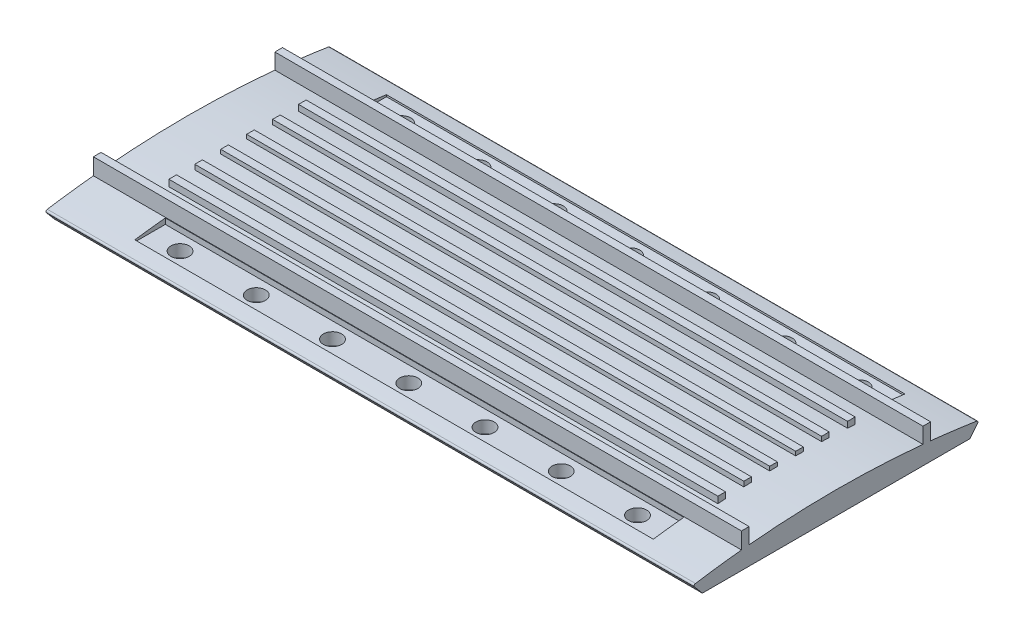
from build123d import *

# Parameters (mm, degrees)
BOSS_EXTRUDE1_DEPTH             = 212.5
BOSS_EXTRUDE1_DEPTH_BACK        = 212.5
SKETCH3_R                       = 6
CUT_EXTRUDE1_DEPTH              = 299.531180557
FILLET1_R                       = 1
BOSS_EXTRUDE2_DEPTH             = 150
BOSS_EXTRUDE2_DEPTH_BACK        = 200
SKETCH4_W                       = 5
SKETCH4_H                       = 12
SKETCH4_H_2                     = 30
SKETCH4_H_3                     = 45
SKETCH4_H_4                     = 60
BOSS_EXTRUDE3_REACH             = 300.248
SKETCH5_W                       = 5
SKETCH5_H                       = 15
BOSS_EXTRUDE3_DIRECTION_2_REACH = 300.248
BOSS_EXTRUDE4_DEPTH             = 180
BOSS_EXTRUDE4_DEPTH_BACK        = 180
SKETCH6_W                       = 5
SKETCH6_H                       = 10
CUT_EXTRUDE2_DEPTH              = 175
CUT_EXTRUDE2_DEPTH_BACK         = 165
SKETCH7_W                       = 20
SKETCH7_H                       = 7


with BuildPart() as part:
    # Sketch2 → Boss-Extrude1 (new, two sides: drawn at the far end of the back side and taken through both)
    with BuildSketch(Plane(origin=(0, 0, 0), x_dir=(0, 0, -1), z_dir=(1, 0, 0)).offset(-BOSS_EXTRUDE1_DEPTH_BACK)):
        with BuildLine():
            Line((-87.681240867, 172.53405461), (-93.974488101, 180.03405461))
            ThreePointArc((-93.974488101, 180.03405461), (0, 187.439087042), (93.974488101, 180.03405461))
            Line((93.974488101, 180.03405461), (87.681240867, 172.53405461))
            Line((87.681240867, 172.53405461), (-87.681240867, 172.53405461))
        make_face()
    extrude(amount=BOSS_EXTRUDE1_DEPTH + BOSS_EXTRUDE1_DEPTH_BACK)

    # Sketch3 → Cut-Extrude1 (cut, through all)
    with BuildSketch(Plane(origin=(0, 0, 0), x_dir=(1, 0, 0), z_dir=(0, 1, 0))):
        with Locations((-145, 72.681240867)):
            Circle(SKETCH3_R)
        with Locations((-95, 72.681240867)):
            Circle(SKETCH3_R)
        with Locations((-45, 72.681240867)):
            Circle(SKETCH3_R)
        with Locations((5, 72.681240867)):
            Circle(SKETCH3_R)
        with Locations((55, 72.681240867)):
            Circle(SKETCH3_R)
        with Locations((105, 72.681240867)):
            Circle(SKETCH3_R)
        with Locations((155, 72.681240867)):
            Circle(SKETCH3_R)
    cut_extrude1 = extrude(amount=CUT_EXTRUDE1_DEPTH, mode=Mode.SUBTRACT)

    # Mirror1: Cut-Extrude1 across plane
    add(cut_extrude1.mirror(Plane.XY), mode=Mode.SUBTRACT)

    # Fillet1
    fillet1_edges = [part.edges().sort_by_distance(p)[0] for p in [
        (0, 180.03405461, -93.974488101),
        (0, 180.03405461, 93.974488101),
    ]]
    fillet(fillet1_edges, radius=FILLET1_R)

    # Sketch4 → Boss-Extrude2 (add, two sides: drawn at the far end of the back side and taken through both)
    with BuildSketch(Plane(origin=(0, 0, 0), x_dir=(0, 0, -1), z_dir=(1, 0, 0)).offset(-BOSS_EXTRUDE2_DEPTH_BACK)):
        with Locations((-59.5, 166.53405461)):
            Rectangle(SKETCH4_W, SKETCH4_H)
        with Locations((-42.5, 157.53405461)):
            Rectangle(SKETCH4_W, SKETCH4_H_2)
        with Locations((-25.5, 150.03405461)):
            Rectangle(SKETCH4_W, SKETCH4_H_3)
        with Locations((-8.5, 142.53405461)):
            Rectangle(SKETCH4_W, SKETCH4_H_4)
        with Locations((8.5, 142.53405461)):
            Rectangle(SKETCH4_W, SKETCH4_H_4)
        with Locations((25.5, 150.03405461)):
            Rectangle(SKETCH4_W, SKETCH4_H_3)
        with Locations((59.5, 166.53405461)):
            Rectangle(SKETCH4_W, SKETCH4_H)
        with Locations((42.5, 157.53405461)):
            Rectangle(SKETCH4_W, SKETCH4_H_2)
    extrude(amount=BOSS_EXTRUDE2_DEPTH + BOSS_EXTRUDE2_DEPTH_BACK)

    # Boss-Extrude3: up to this face of the body (flat: up to its plane)
    boss_extrude3_end = Plane(part.part.faces().sort_by_distance((212.5, 179.031198014, 0))[0])
    # Sketch5 → Boss-Extrude3 (add, up to the picked face)
    with BuildSketch(Plane(origin=(0, 0, 0), x_dir=(0, 0, -1), z_dir=(1, 0, 0)), mode=Mode.PRIVATE) as boss_extrude3_sk1:
        with Locations((-59.5, 187.53405461)):
            Rectangle(SKETCH5_W, SKETCH5_H)
    boss_extrude3_tool1 = split(extrude(boss_extrude3_sk1.sketch, amount=BOSS_EXTRUDE3_REACH, mode=Mode.PRIVATE), bisect_by=boss_extrude3_end, keep=Keep.BOTH, mode=Mode.PRIVATE)
    # Sketch5 → Boss-Extrude3 (add, up to the picked face)
    with BuildSketch(Plane(origin=(0, 0, 0), x_dir=(0, 0, -1), z_dir=(1, 0, 0)), mode=Mode.PRIVATE) as boss_extrude3_sk2:
        with Locations((59.5, 187.53405461)):
            Rectangle(SKETCH5_W, SKETCH5_H)
    boss_extrude3_tool2 = split(extrude(boss_extrude3_sk2.sketch, amount=BOSS_EXTRUDE3_REACH, mode=Mode.PRIVATE), bisect_by=boss_extrude3_end, keep=Keep.BOTH, mode=Mode.PRIVATE)
    add(boss_extrude3_tool1.solids().sort_by(Axis((0, 187.534055, 59.5), (1, 0, 0)))[0])
    add(boss_extrude3_tool2.solids().sort_by(Axis((0, 187.534055, -59.5), (1, 0, 0)))[0])

    # Boss-Extrude3 direction 2: up to this face of the body (flat: up to its plane)
    boss_extrude3_direction_2_end = Plane(part.part.faces().sort_by_distance((-212.5, 179.031198014, 0))[0])
    # Sketch5 → Boss-Extrude3 direction 2 (add, up to the picked face)
    with BuildSketch(Plane(origin=(0, 0, 0), x_dir=(0, 0, -1), z_dir=(1, 0, 0)), mode=Mode.PRIVATE) as boss_extrude3_direction_2_sk1:
        with Locations((-59.5, 187.53405461)):
            Rectangle(SKETCH5_W, SKETCH5_H)
    boss_extrude3_direction_2_tool1 = split(extrude(boss_extrude3_direction_2_sk1.sketch, amount=-BOSS_EXTRUDE3_DIRECTION_2_REACH, mode=Mode.PRIVATE), bisect_by=boss_extrude3_direction_2_end, keep=Keep.BOTH, mode=Mode.PRIVATE)
    # Sketch5 → Boss-Extrude3 direction 2 (add, up to the picked face)
    with BuildSketch(Plane(origin=(0, 0, 0), x_dir=(0, 0, -1), z_dir=(1, 0, 0)), mode=Mode.PRIVATE) as boss_extrude3_direction_2_sk2:
        with Locations((59.5, 187.53405461)):
            Rectangle(SKETCH5_W, SKETCH5_H)
    boss_extrude3_direction_2_tool2 = split(extrude(boss_extrude3_direction_2_sk2.sketch, amount=-BOSS_EXTRUDE3_DIRECTION_2_REACH, mode=Mode.PRIVATE), bisect_by=boss_extrude3_direction_2_end, keep=Keep.BOTH, mode=Mode.PRIVATE)
    add(boss_extrude3_direction_2_tool1.solids().sort_by(Axis((0, 187.534055, 59.5), (-1, 0, 0)))[0])
    add(boss_extrude3_direction_2_tool2.solids().sort_by(Axis((0, 187.534055, -59.5), (-1, 0, 0)))[0])

    # Sketch6 → Boss-Extrude4 (add, two sides: drawn at the far end of the back side and taken through both)
    with BuildSketch(Plane(origin=(0, 0, 0), x_dir=(0, 0, -1), z_dir=(1, 0, 0)).offset(-BOSS_EXTRUDE4_DEPTH_BACK)):
        with Locations((-42.5, 185.03405461)):
            Rectangle(SKETCH6_W, SKETCH6_H)
        with Locations((-25.5, 185.03405461)):
            Rectangle(SKETCH6_W, SKETCH6_H)
        with Locations((-8.5, 185.03405461)):
            Rectangle(SKETCH6_W, SKETCH6_H)
        with Locations((8.5, 185.03405461)):
            Rectangle(SKETCH6_W, SKETCH6_H)
        with Locations((25.5, 185.03405461)):
            Rectangle(SKETCH6_W, SKETCH6_H)
        with Locations((42.5, 185.03405461)):
            Rectangle(SKETCH6_W, SKETCH6_H)
    extrude(amount=BOSS_EXTRUDE4_DEPTH + BOSS_EXTRUDE4_DEPTH_BACK)

    # Sketch7 → Cut-Extrude2 (cut, two sides: drawn at the far end of the back side and taken through both)
    with BuildSketch(Plane(origin=(0, 0, 0), x_dir=(0, 0, -1), z_dir=(1, 0, 0)).offset(-CUT_EXTRUDE2_DEPTH_BACK)):
        with Locations((-72.318759133, 184.03405461)):
            Rectangle(SKETCH7_W, SKETCH7_H)
        with Locations((72.681240867, 184.03405461)):
            Rectangle(SKETCH7_W, SKETCH7_H)
    extrude(amount=CUT_EXTRUDE2_DEPTH + CUT_EXTRUDE2_DEPTH_BACK, mode=Mode.SUBTRACT)


solid = part.part
